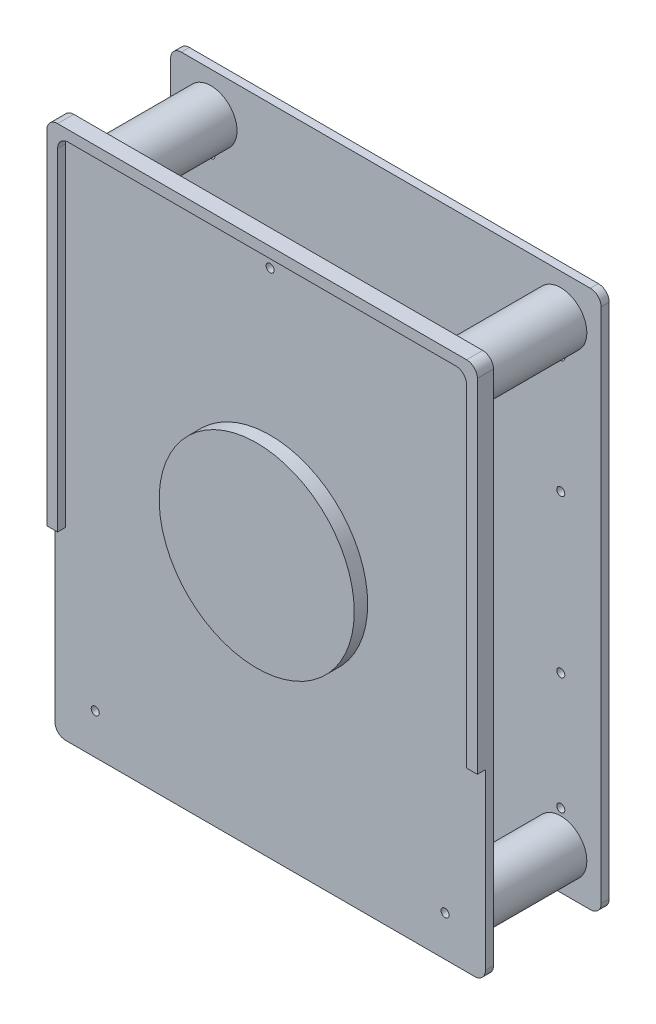
from build123d import *

# Parameters (mm, degrees)
SKETCH1_R           = 36.25
SKETCH1_R_2         = 1.495
BOSS_EXTRUDE1_DEPTH = 3
SKETCH1_3_R         = 1.495
CUT_EXTRUDE2_DEPTH  = 3
SKETCH1_4_R         = 1.495
CUT_EXTRUDE3_DEPTH  = 3
SKETCH1_6_R         = 9.688899653
BOSS_EXTRUDE2_DEPTH = 40
BOSS_EXTRUDE3_START = -40
SKETCH1_7_R         = 9.688899653
SKETCH1_7_R_2       = 1.495
BOSS_EXTRUDE3_DEPTH = 40
BOSS_EXTRUDE4_START = 3
BOSS_EXTRUDE4_DEPTH = 3
SKETCH1_8_R         = 36.25
BOSS_EXTRUDE5_DEPTH = 8
BOSS_EXTRUDE6_DEPTH = 3
SKETCH4_R           = 1.495
CUT_EXTRUDE4_DEPTH  = 3


with BuildPart() as part:
    # Sketch1 → Boss-Extrude1 (new body)
    with BuildSketch(Plane.XY):
        with BuildLine():
            ThreePointArc((0, 4), (1.171572875, 1.171572875), (4, 0))
            Line((4, 0), (156, 0))
            ThreePointArc((156, 0), (158.828427125, 1.171572875), (160, 4))
            Line((160, 4), (160, 196))
            ThreePointArc((160, 196), (158.828427125, 198.828427125), (156, 200))
            Line((156, 200), (4, 200))
            ThreePointArc((4, 200), (1.171572875, 198.828427125), (0, 196))
            Line((0, 196), (0, 4))
        make_face()
        with Locations((80, 100)):
            Circle(SKETCH1_R, mode=Mode.SUBTRACT)
        with Locations((80, 190)):
            Circle(SKETCH1_R_2, mode=Mode.SUBTRACT)
    extrude(amount=BOSS_EXTRUDE1_DEPTH)

    # Sketch1<3> → Cut-Extrude2 (cut)
    with BuildSketch(Plane.XY):
        with Locations((15, 15)):
            Circle(SKETCH1_3_R)
    extrude(amount=CUT_EXTRUDE2_DEPTH, mode=Mode.SUBTRACT)

    # Sketch1<4> → Cut-Extrude3 (cut)
    with BuildSketch(Plane.XY):
        with Locations((145, 15)):
            Circle(SKETCH1_4_R)
    extrude(amount=CUT_EXTRUDE3_DEPTH, mode=Mode.SUBTRACT)

    # Sketch1<6> → Boss-Extrude2 (add)
    with BuildSketch(Plane.XY):
        with Locations((145, 185)):
            Circle(SKETCH1_6_R)
    extrude(amount=-BOSS_EXTRUDE2_DEPTH)

    # Sketch1<7> → Boss-Extrude3 (add)
    # profile 1 of 3: a face of its own
    with BuildSketch(Plane.XY.offset(BOSS_EXTRUDE3_START)):
        with Locations((15, 15)):
            Circle(SKETCH1_7_R)
        with Locations((15, 15)):
            Circle(SKETCH1_7_R_2, mode=Mode.SUBTRACT)
    # profile 2 of 3: a face of its own
    with BuildSketch(Plane.XY.offset(BOSS_EXTRUDE3_START)):
        with Locations((145, 15)):
            Circle(SKETCH1_7_R)
        with Locations((145, 15)):
            Circle(SKETCH1_7_R_2, mode=Mode.SUBTRACT)
    # profile 3 of 3: a face of its own
    with BuildSketch(Plane.XY.offset(BOSS_EXTRUDE3_START)):
        with Locations((15, 185)):
            Circle(SKETCH1_7_R)
    extrude(amount=BOSS_EXTRUDE3_DEPTH)

    # Sketch2 → Boss-Extrude4 (add)
    with BuildSketch(Plane(origin=(0, 0, -40), x_dir=(-1, 0, 0), z_dir=(0, 0, -1)).offset(BOSS_EXTRUDE4_START)):
        with BuildLine():
            Line((-156, 200), (-4, 200))
            ThreePointArc((-4, 200), (-1.171572875, 198.828427125), (0, 196))
            Line((0, 196), (0, 4))
            ThreePointArc((0, 4), (-1.171572875, 1.171572875), (-4, 0))
            Line((-4, 0), (-156, 0))
            ThreePointArc((-156, 0), (-158.828427125, 1.171572875), (-160, 4))
            Line((-160, 4), (-160, 196))
            ThreePointArc((-160, 196), (-158.828427125, 198.828427125), (-156, 200))
        make_face()
    extrude(amount=-BOSS_EXTRUDE4_DEPTH)

    # Sketch1<8> → Boss-Extrude5 (add)
    with BuildSketch(Plane.XY):
        with Locations((80, 100)):
            Circle(SKETCH1_8_R)
    extrude(amount=BOSS_EXTRUDE5_DEPTH)

    # Sketch3 → Boss-Extrude6 (add)
    with BuildSketch(Plane.XY.offset(3)):
        with BuildLine():
            Line((0, 68.573310073), (0, 196))
            ThreePointArc((0, 196), (1.171572875, 198.828427125), (4, 200))
            Line((4, 200), (156, 200))
            ThreePointArc((156, 200), (158.828427125, 198.828427125), (160, 196))
            Line((160, 196), (160, 68.573310073))
            Line((160, 68.573310073), (156, 68.573310073))
            Line((156, 68.573310073), (156, 192))
            ThreePointArc((156, 192), (154.828427125, 194.828427125), (152, 196))
            Line((152, 196), (8, 196))
            ThreePointArc((8, 196), (5.171572875, 194.828427125), (4, 192))
            Line((4, 192), (4, 68.573310073))
            Line((4, 68.573310073), (0, 68.573310073))
        make_face()
    extrude(amount=BOSS_EXTRUDE6_DEPTH)

    # Sketch4 → Cut-Extrude4 (cut)
    with BuildSketch(Plane.XY.offset(-40)):
        with Locations((15, 27.247777485)):
            Circle(SKETCH4_R)
        with Locations((145, 27.247777485)):
            Circle(SKETCH4_R)
        with Locations((145, 172.752222515)):
            Circle(SKETCH4_R)
        with Locations((15, 172.752222515)):
            Circle(SKETCH4_R)
        with Locations((15, 129.079723254)):
            Circle(SKETCH4_R)
        with Locations((15, 70.716662913)):
            Circle(SKETCH4_R)
        with Locations((145, 70.716662913)):
            Circle(SKETCH4_R)
        with Locations((145, 129.079723254)):
            Circle(SKETCH4_R)
    extrude(amount=-CUT_EXTRUDE4_DEPTH, mode=Mode.SUBTRACT)


solid = part.part
